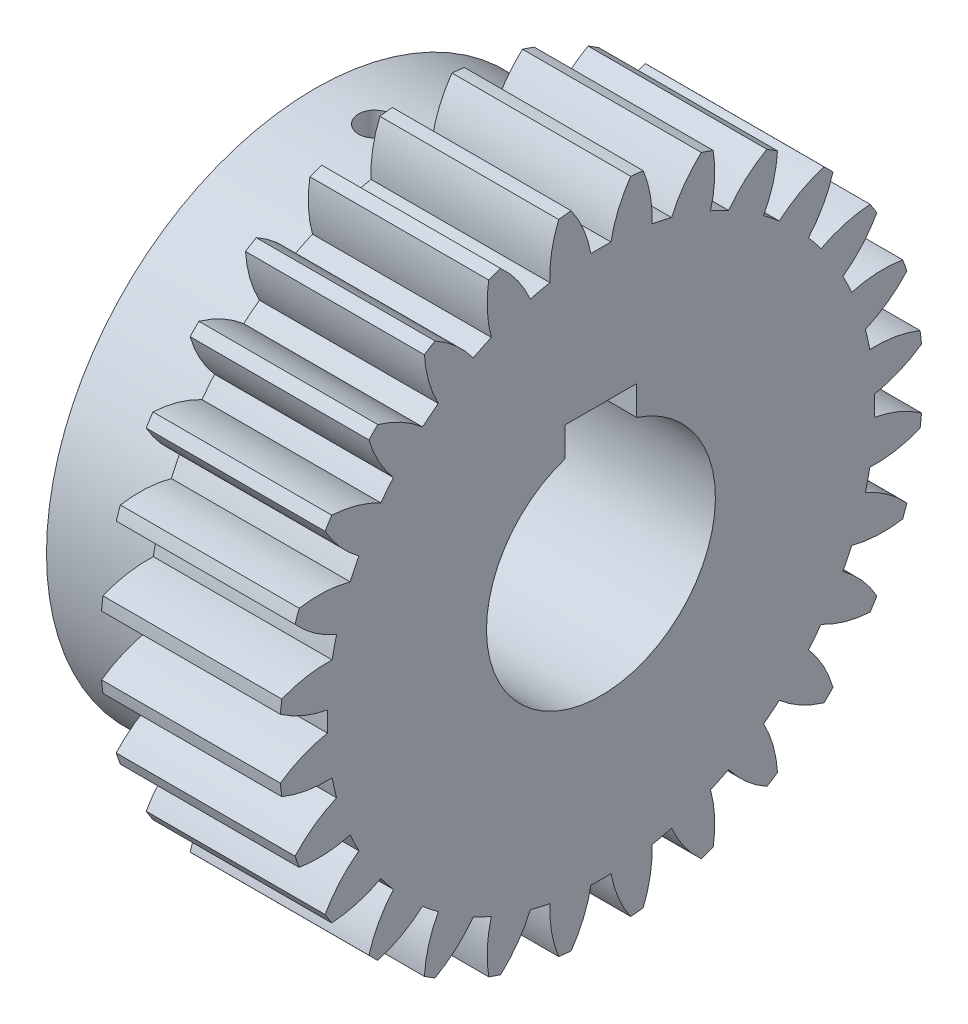
from build123d import *

# Parameters (mm, degrees)
BASPROSKE_W           = 25
BASPROSKE_H           = 45
TOOTHCUT_DEPTH        = 69.373971656
TEETHCUTS_COUNT       = 28
TEETHCUTS_ANGLE       = 347.142857143
HUBNEAONESKE_R        = 37.5
HUBNEARONE_DEPTH      = 15.0000508
BORSKE_R              = 16
BORE_DEPTH            = 40.0000508
KEYSKE_W              = 10
KEYSKE_H              = 19.3
KEYWAY_DEPTH          = 40.0000508
CROQUIS1_R            = 2.38125
CORTAR_EXTRUIR1_DEPTH = 50
CROQUIS2_W            = 9.5
CROQUIS2_H            = 4
CORTAR_EXTRUIR2_DEPTH = 18


with BuildPart() as part:
    # BasProSke → Base-Revolve (revolve)
    with BuildSketch(Plane(origin=(0, 0, 0), x_dir=(1, 0, 0), z_dir=(0, 1, 0)), mode=Mode.PRIVATE) as base_revolve_sk:
        with Locations((12.5, 22.5)):
            Rectangle(BASPROSKE_W, BASPROSKE_H)
    revolve(base_revolve_sk.sketch.rotate(Axis((-10, 0, 0), (1, 0, 0)), 180), axis=Axis((-10, 0, 0), (1, 0, 0)))

    # TooCutSke → ToothCut (cut, through all)
    with BuildSketch(Plane(origin=(0, 0, 0), x_dir=(0, 0, -1), z_dir=(1, 0, 0))):
        with BuildLine():
            ThreePointArc((1.403213633, 38.223251988), (0, 38.249), (-1.403213633, 38.223251988))
            ThreePointArc((-1.403213633, 38.223251988), (-2.43634991, 41.67694432), (-4.182509757, 44.830717787))
            ThreePointArc((-4.182509757, 44.830717787), (0, 45.0254), (4.182509757, 44.830717787))
            ThreePointArc((4.182509757, 44.830717787), (2.43634991, 41.67694432), (1.403213633, 38.223251988))
        make_face()
    toothcut = extrude(amount=TOOTHCUT_DEPTH, mode=Mode.SUBTRACT)

    # TeethCuts: ToothCut ×28 about axis
    teethcuts_axis = Axis((-10, 0, 0), (1, 0, 0))
    for i in range(1, TEETHCUTS_COUNT):
        add(toothcut.rotate(teethcuts_axis, i * TEETHCUTS_ANGLE / (TEETHCUTS_COUNT - 1)), mode=Mode.SUBTRACT)

    # HubNeaOneSke → HubNearOne (add)
    with BuildSketch(Plane.ZY):
        with Locations(Location((0, 0, 0), (0, 0, 180))):
            Circle(HUBNEAONESKE_R)
    extrude(amount=HUBNEARONE_DEPTH)

    # BorSke → Bore (cut, symmetric)
    with BuildSketch(Plane(origin=(0, 0, 0), x_dir=(0, 0, -1), z_dir=(1, 0, 0))):
        with Locations(Location((0, 0, 0), (0, 0, 180))):
            Circle(BORSKE_R)
    extrude(amount=BORE_DEPTH, both=True, mode=Mode.SUBTRACT)

    # KeySke → Keyway (cut, symmetric)
    with BuildSketch(Plane(origin=(0, 0, 0), x_dir=(0, 0, -1), z_dir=(1, 0, 0))):
        with Locations((0, 9.65)):
            Rectangle(KEYSKE_W, KEYSKE_H)
    extrude(amount=KEYWAY_DEPTH, both=True, mode=Mode.SUBTRACT)

    # Croquis1 → Cortar-Extruir1 (cut, symmetric)
    with BuildSketch(Plane(origin=(0, 0, 0), x_dir=(1, 0, 0), z_dir=(0, 1, 0))):
        with Locations(Location((-6.5, 0, 0), (0, 0, 270))):
            Circle(CROQUIS1_R)
    extrude(amount=CORTAR_EXTRUIR1_DEPTH, both=True, mode=Mode.SUBTRACT)

    # Croquis2 → Cortar-Extruir2 (cut)
    with BuildSketch(Plane.ZY.offset(15.0000508)):
        with Locations((0, 27)):
            Rectangle(CROQUIS2_W, CROQUIS2_H)
        with Locations((0, -27)):
            Rectangle(CROQUIS2_W, CROQUIS2_H)
    extrude(amount=-CORTAR_EXTRUIR2_DEPTH, mode=Mode.SUBTRACT)


solid = part.part
